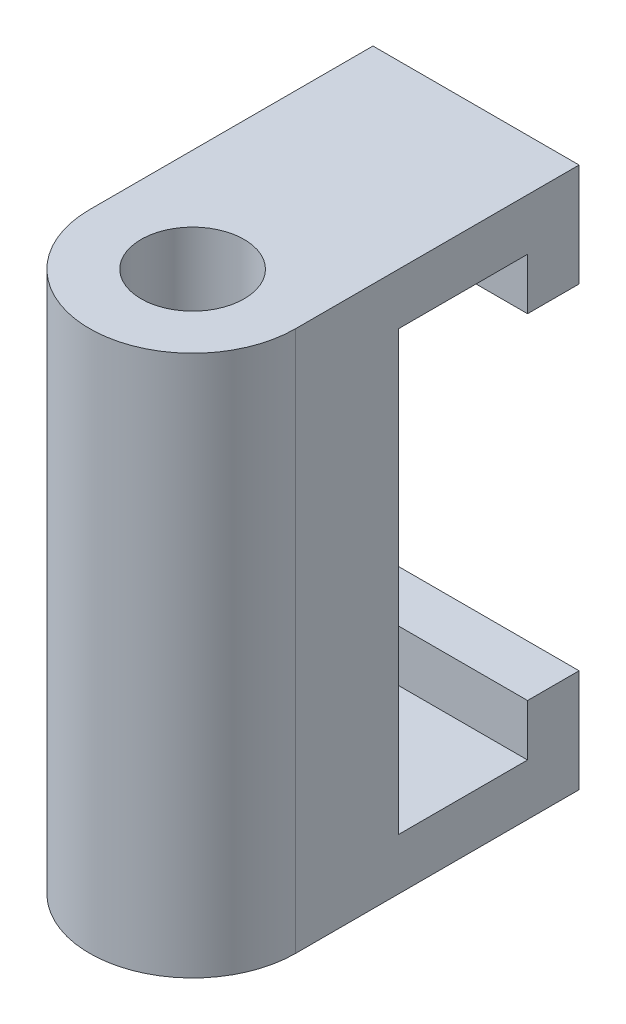
from build123d import *

# Parameters (mm, degrees)
SKETCH1_R           = 1.5875
BOSS_EXTRUDE1_DEPTH = 16.66875
CUT_EXTRUDE1_DEPTH  = 20.859618655


with BuildPart() as part:
    # Sketch1 → Boss-Extrude1 (new body)
    with BuildSketch(Plane(origin=(0, 0, 0), x_dir=(1, 0, 0), z_dir=(0, 1, 0))):
        with BuildLine():
            Line((-3.175, 0), (-3.175, 8.73125))
            Line((-3.175, 8.73125), (3.175, 8.73125))
            Line((3.175, 8.73125), (3.175, 0))
            ThreePointArc((3.175, 0), (0, -3.175), (-3.175, 0))
        make_face()
        with Locations(Location((0, 0, 0), (0, 0, 270))):
            Circle(SKETCH1_R, mode=Mode.SUBTRACT)
    extrude(amount=BOSS_EXTRUDE1_DEPTH)

    # Sketch3 → Cut-Extrude1 (cut, through all)
    with BuildSketch(Plane(origin=(3.175, 0, 0), x_dir=(0, 0, -1), z_dir=(1, 0, 0))):
        Polygon((8.73125, 13.49375), (7.14375, 13.49375), (7.14375, 15.08125), (3.175, 15.08125), (3.175, 1.5875), (7.14375, 1.5875), (7.14375, 3.175), (8.73125, 3.175), align=None)
    extrude(amount=-CUT_EXTRUDE1_DEPTH, mode=Mode.SUBTRACT)


solid = part.part
